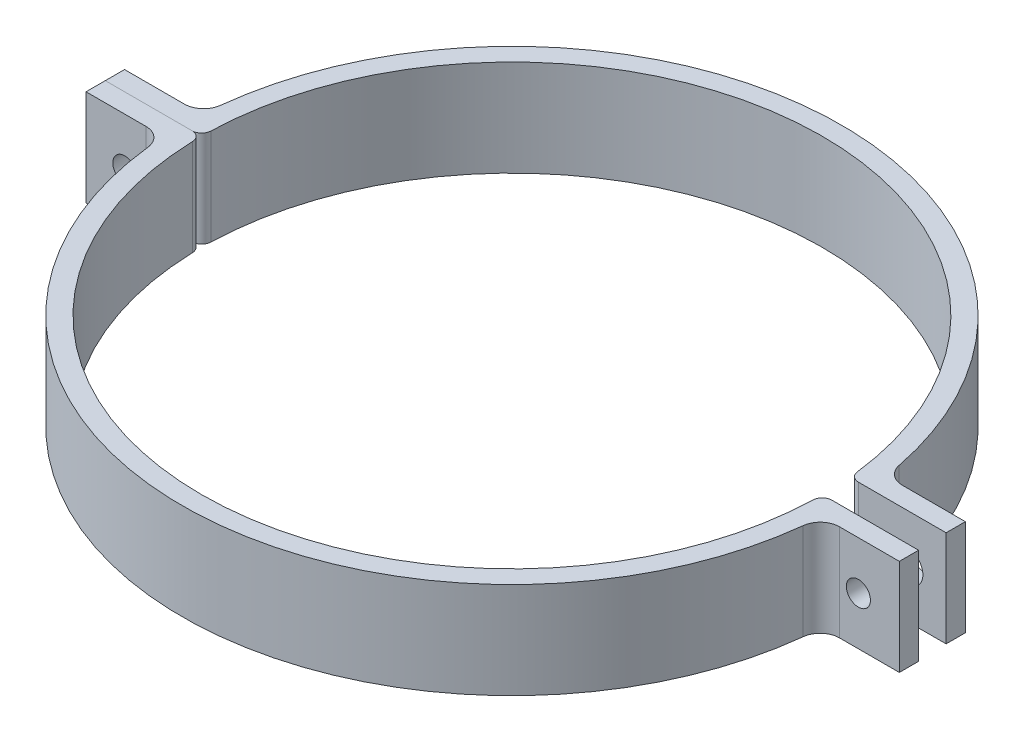
from build123d import *

# Parameters (mm, degrees)
SKETCH_1_R                 = 34.25
SKETCH_1_R_2               = 32.25
EXTRUDE_1_DEPTH            = 10
SKETCH_2_W                 = 6.503294728
SKETCH_2_H                 = 3
CUT_EXTRUDE_1_DEPTH        = 50.458315782
SKETCH_5_W                 = 10
SKETCH_5_H                 = 10
EXTRUDE_2_DEPTH            = 2
SKETCH_6_W                 = 10
SKETCH_6_H                 = 10
EXTRUDE_3_DEPTH            = 2
SKETCH_10_W                = 10
SKETCH_10_H                = 10
EXTRUDE_4_DEPTH            = 2
SKETCH_8_W                 = 1.7
SKETCH_8_H                 = 39.25
HOLE_WIZARD_M31_AT_2_COUNT = 2
HOLE_WIZARD_M31_AT_2_PITCH = 76.217394456
M3X0_51_AT_2_COUNT         = 2
M3X0_51_AT_2_PITCH         = 76.217394456
FILLET_1_R                 = 2
FILLET_3_R                 = 1
FILLET_4_R                 = 1
FILLET_5_R                 = 2


with BuildPart() as part:
    # Эскиз1 → Бобышка-Вытянуть1 (new body)
    with BuildSketch(Plane(origin=(0, 0, 0), x_dir=(1, 0, 0), z_dir=(0, 1, 0))):
        with Locations(Location((0, 0, 0), (0, 0, 270))):
            Circle(SKETCH_1_R)
        with Locations(Location((0, 0, 0), (0, 0, 270))):
            Circle(SKETCH_1_R_2, mode=Mode.SUBTRACT)
    extrude(amount=EXTRUDE_1_DEPTH)


with BuildPart() as body_2:
    # Split Bodies 1: the piece on the far side of the plane
    add(part.part)
    split(bisect_by=Plane.XY, keep=Keep.BOTTOM)

    # Эскиз2 → Вырез-Вытянуть1 (cut, through all)
    with BuildSketch(Plane(origin=(0, 10, 0), x_dir=(1, 0, 0), z_dir=(0, 1, 0))):
        with Locations((30.998352636, 1.5)):
            Rectangle(SKETCH_2_W, SKETCH_2_H)
    extrude(amount=-CUT_EXTRUDE_1_DEPTH, mode=Mode.SUBTRACT)

    # Эскиз5 → Бобышка-Вытянуть2 (add)
    with BuildSketch(Plane.XY.offset(-3)):
        with Locations((37.110161943, 5)):
            Rectangle(SKETCH_5_W, SKETCH_5_H)
    extrude(amount=-EXTRUDE_2_DEPTH)

    # Эскиз6 → Бобышка-Вытянуть3 (add)
    with BuildSketch(Plane.XY):
        with Locations((-37.25, 5)):
            Rectangle(SKETCH_6_W, SKETCH_6_H)
    extrude(amount=-EXTRUDE_3_DEPTH)

    # Эскиз8 → Отверстие с зазором M31 (revolve, cut)
    with BuildSketch(Plane(origin=(37.996616469, 5, -5), x_dir=(0, 1, 0), z_dir=(1, 0, 0))):
        with Locations((0.85, 19.625)):
            Rectangle(SKETCH_8_W, SKETCH_8_H)
    hole_wizard_m31 = revolve(axis=Axis((37.996616469, 5, -11.35), (0, 0, 1)), mode=Mode.SUBTRACT)

    # Отверстие с зазором M31 at 2: Отверстие с зазором M31 ×2
    with Locations(*[(-i * HOLE_WIZARD_M31_AT_2_PITCH, 0, 0) for i in range(1, HOLE_WIZARD_M31_AT_2_COUNT)]):
        add(hole_wizard_m31, mode=Mode.SUBTRACT)

    # Скругление1
    fillet_1_edges = [body_2.edges().sort_by_distance(p)[0] for p in [
        (33.883070994, 5, -5),
        (-34.191555975, 5, -2),
    ]]
    fillet(fillet_1_edges, radius=FILLET_1_R)

    # Скругление3
    fillet_3_edges = [body_2.edges().sort_by_distance(p)[0] for p in [
        (32.110161943, 5, -3),
        (-32.25, 5, 0),
    ]]
    fillet(fillet_3_edges, radius=FILLET_3_R)


with BuildPart() as part_1:
    add(part.part)

    # Split Bodies 1
    split(bisect_by=Plane.XY, keep=Keep.TOP)

    # Эскиз10 → Бобышка-Вытянуть4 (add)
    with BuildSketch(Plane(origin=(0, 0, 0), x_dir=(-1, 0, 0), z_dir=(0, 0, -1))):
        with Locations((37.25, 5)):
            Rectangle(SKETCH_10_W, SKETCH_10_H)
        with Locations((-37.25, 5)):
            Rectangle(SKETCH_10_W, SKETCH_10_H)
    extrude(amount=-EXTRUDE_4_DEPTH)

    # Эскиз11 → Отверстие обработанное метчиком M3x0.51 (revolve, cut)
    with BuildSketch(Plane(origin=(37.996616469, 5, 2), x_dir=(0, -1, 0), z_dir=(1, 0, 0))):
        Polygon((0, 0), (0, 9.251075774), (1.25, 8.5), (1.25, 0), align=None)
    m3x0_51 = revolve(axis=Axis((37.996616469, 5, 8.35), (0, 0, -1)), mode=Mode.SUBTRACT)

    # Отверстие обработанное метчиком M3x0.51 at 2: Отверстие обработанное метчиком M3x0.51 ×2
    with Locations(*[(-i * M3X0_51_AT_2_PITCH, 0, 0) for i in range(1, M3X0_51_AT_2_COUNT)]):
        add(m3x0_51, mode=Mode.SUBTRACT)

    # Скругление4
    fillet_4_edges = [part_1.edges().sort_by_distance(p)[0] for p in [
        (-32.25, 5, 0),
        (32.25, 5, 0),
    ]]
    fillet(fillet_4_edges, radius=FILLET_4_R)

    # Скругление5
    fillet_5_edges = [part_1.edges().sort_by_distance(p)[0] for p in [
        (-34.191555975, 5, 2),
        (34.191555975, 5, 2),
    ]]
    fillet(fillet_5_edges, radius=FILLET_5_R)


solid = Compound([body_2.part, part_1.part])
